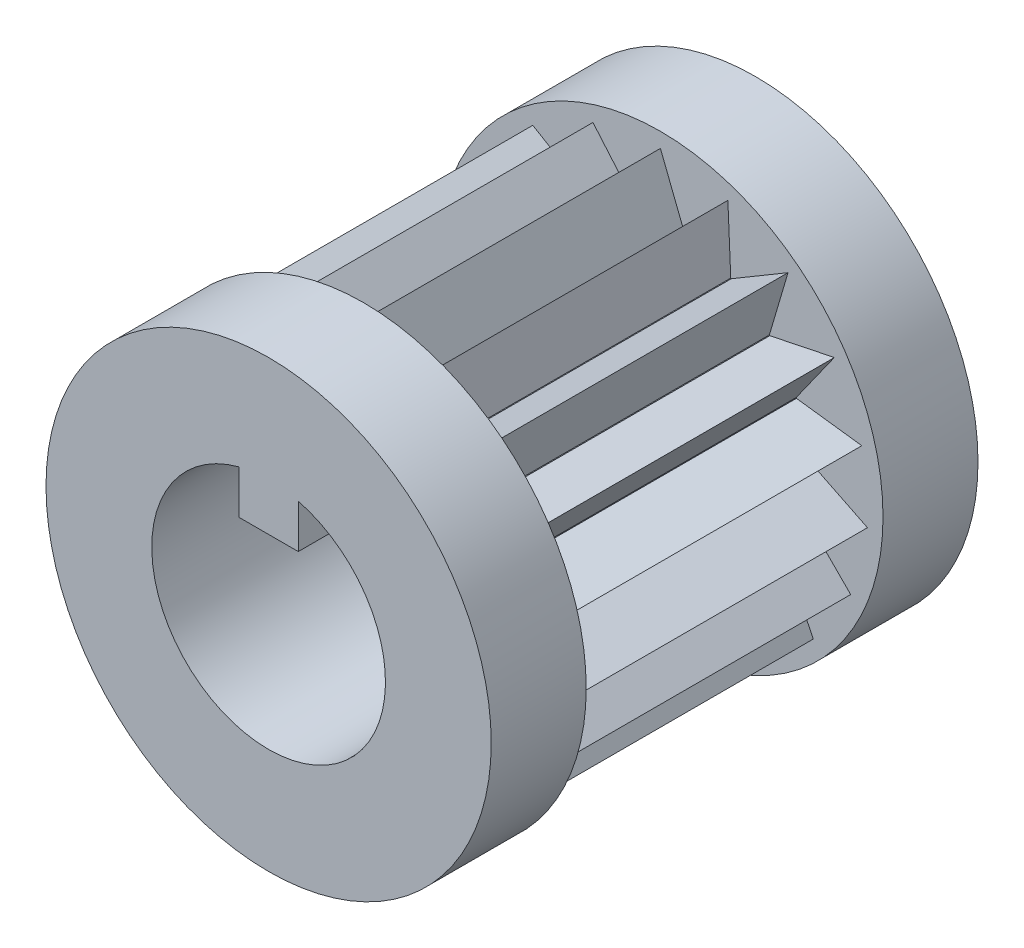
from build123d import *

# Parameters (mm, degrees)
BOSS_EXTRUDE1_DEPTH = 3.175
SKETCH2_R           = 4.7625
BOSS_EXTRUDE2_DEPTH = 2.032
CUT_EXTRUDE1_DEPTH  = 17.018


with BuildPart() as part:
    # Sketch1 → Boss-Extrude1 (new body)
    with BuildSketch(Plane.XY):
        with BuildLine():
            Line((0, 4.445), (0.515524368, 3.132867636))
            ThreePointArc((0.515524368, 3.132867636), (0.522587824, 3.131697138), (0.529648623, 3.130510715))
            Line((0.529648623, 3.130510715), (1.443289141, 4.204157639))
            Line((1.443289141, 4.204157639), (1.504832294, 2.795729738))
            ThreePointArc((1.504832294, 2.795729738), (1.511132973, 2.79232916), (1.517425967, 2.788914383))
            Line((1.517425967, 2.788914383), (2.730175508, 3.507729564))
            Line((2.730175508, 3.507729564), (2.331068291, 2.155631142))
            ThreePointArc((2.331068291, 2.155631142), (2.335923416, 2.15036899), (2.340766663, 2.145095903))
            Line((2.340766663, 2.145095903), (3.721204996, 2.431184563))
            Line((3.721204996, 2.431184563), (2.904696869, 1.281936464))
            ThreePointArc((2.904696869, 1.281936464), (2.907580312, 1.275382973), (2.910448969, 1.268822997))
            Line((2.910448969, 1.268822997), (4.308984182, 1.09118299))
            Line((4.308984182, 1.09118299), (3.16355647, 0.269324079))
            ThreePointArc((3.16355647, 0.269324079), (3.164155765, 0.262189422), (3.16473897, 0.255053432))
            Line((3.16473897, 0.255053432), (4.429818071, -0.367065191))
            Line((4.429818071, -0.367065191), (3.07959564, -0.772473749))
            ThreePointArc((3.07959564, -0.772473749), (3.077845844, -0.779416422), (3.076080397, -0.78635513))
            Line((3.076080397, -0.78635513), (4.070612437, -1.785536163))
            Line((4.070612437, -1.785536163), (2.661912838, -1.730562061))
            ThreePointArc((2.661912838, -1.730562061), (2.658003568, -1.736560402), (2.654080783, -1.742549913))
            Line((2.654080783, -1.742549913), (3.270292783, -3.010516586))
            Line((3.270292783, -3.010516586), (1.955770475, -2.50111712))
            ThreePointArc((1.955770475, -2.50111712), (1.950125363, -2.505521117), (1.944470334, -2.509912373))
            Line((1.944470334, -2.509912373), (2.115586162, -3.909260824))
            Line((2.115586162, -3.909260824), (1.037690035, -3.000637331))
            ThreePointArc((1.037690035, -3.000637331), (1.030920815, -3.002969742), (1.024146352, -3.005286883))
            Line((1.024146352, -3.005286883), (0.731622954, -4.384375994))
            Line((0.731622954, -4.384375994), (0.007159778, -3.174991927))
            ThreePointArc((0.007159778, -3.174991927), (0, -3.175), (-0.007159778, -3.174991927))
            Line((-0.007159778, -3.174991927), (-0.731622954, -4.384375994))
            Line((-0.731622954, -4.384375994), (-1.024146352, -3.005286883))
            ThreePointArc((-1.024146352, -3.005286883), (-1.030920815, -3.002969742), (-1.037690035, -3.000637331))
            Line((-1.037690035, -3.000637331), (-2.115586162, -3.909260824))
            Line((-2.115586162, -3.909260824), (-1.944470334, -2.509912373))
            ThreePointArc((-1.944470334, -2.509912373), (-1.950125363, -2.505521117), (-1.955770475, -2.50111712))
            Line((-1.955770475, -2.50111712), (-3.270292783, -3.010516586))
            Line((-3.270292783, -3.010516586), (-2.654080783, -1.742549913))
            ThreePointArc((-2.654080783, -1.742549913), (-2.658003568, -1.736560402), (-2.661912838, -1.730562061))
            Line((-2.661912838, -1.730562061), (-4.070612437, -1.785536163))
            Line((-4.070612437, -1.785536163), (-3.076080397, -0.78635513))
            ThreePointArc((-3.076080397, -0.78635513), (-3.077845844, -0.779416422), (-3.07959564, -0.772473749))
            Line((-3.07959564, -0.772473749), (-4.429818071, -0.367065191))
            Line((-4.429818071, -0.367065191), (-3.16473897, 0.255053432))
            ThreePointArc((-3.16473897, 0.255053432), (-3.164155765, 0.262189422), (-3.16355647, 0.269324079))
            Line((-3.16355647, 0.269324079), (-4.308984182, 1.09118299))
            Line((-4.308984182, 1.09118299), (-2.910448969, 1.268822997))
            ThreePointArc((-2.910448969, 1.268822997), (-2.907580312, 1.275382973), (-2.904696869, 1.281936464))
            Line((-2.904696869, 1.281936464), (-3.721204996, 2.431184563))
            Line((-3.721204996, 2.431184563), (-2.340766663, 2.145095903))
            ThreePointArc((-2.340766663, 2.145095903), (-2.335923416, 2.15036899), (-2.331068291, 2.155631142))
            Line((-2.331068291, 2.155631142), (-2.730175508, 3.507729564))
            Line((-2.730175508, 3.507729564), (-1.517425967, 2.788914383))
            ThreePointArc((-1.517425967, 2.788914383), (-1.511132973, 2.79232916), (-1.504832294, 2.795729738))
            Line((-1.504832294, 2.795729738), (-1.443289141, 4.204157639))
            Line((-1.443289141, 4.204157639), (-0.529648623, 3.130510715))
            ThreePointArc((-0.529648623, 3.130510715), (-0.522587824, 3.131697138), (-0.515524368, 3.132867636))
            Line((-0.515524368, 3.132867636), (0, 4.445))
        make_face()
    extrude(amount=BOSS_EXTRUDE1_DEPTH)

    # Sketch2 → Boss-Extrude2 (add)
    with BuildSketch(Plane(origin=(0, 0, 0), x_dir=(-1, 0, 0), z_dir=(0, 0, -1))):
        Circle(SKETCH2_R)
    extrude(amount=BOSS_EXTRUDE2_DEPTH)

    # Mirror1: part across plane


with BuildPart() as part_1:
    add(part.part)
    add(part.part.mirror(Plane.XY.offset(3.175)))

    # Sketch3 → Cut-Extrude1 (cut)
    with BuildSketch(Plane(origin=(0, 0, -2.032), x_dir=(-1, 0, 0), z_dir=(0, 0, -1))):
        with BuildLine():
            Line((-0.635, 2.418010546), (-0.635, 1.484))
            Line((-0.635, 1.484), (0.635, 1.484))
            Line((0.635, 1.484), (0.635, 2.418010546))
            ThreePointArc((0.635, 2.418010546), (0, -2.5), (-0.635, 2.418010546))
        make_face()
    extrude(amount=-CUT_EXTRUDE1_DEPTH, mode=Mode.SUBTRACT)


solid = part_1.part
